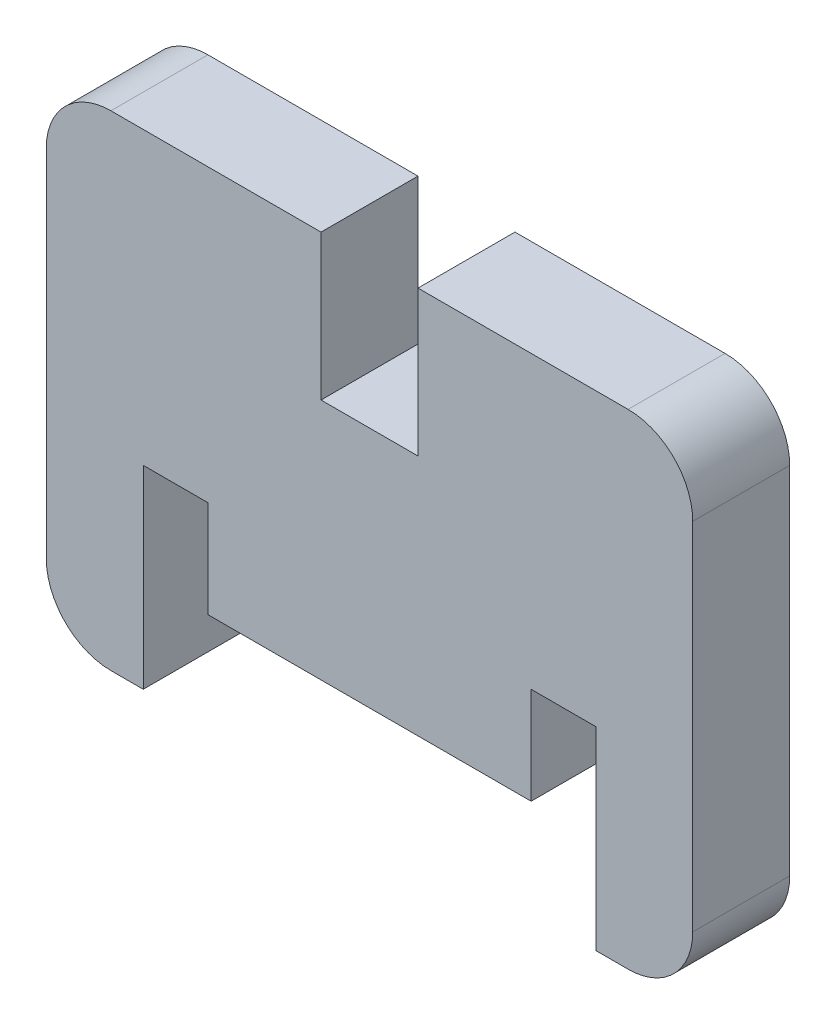
from build123d import *

# Parameters (mm, degrees)
BOSS_EXTRU_1_DEPTH = 15


with BuildPart() as part:
    # Esquisse1 → Boss.-Extru.1 (new body)
    with BuildSketch(Plane.XY):
        with BuildLine():
            ThreePointArc((-50, -27.5), (-47.071067812, -34.571067812), (-40, -37.5))
            Line((-40, -37.5), (-35, -37.5))
            Line((-35, -37.5), (-35, -22.5))
            Line((-35, -22.5), (-35, -7.5))
            Line((-35, -7.5), (-25, -7.5))
            Line((-25, -7.5), (-25, -22.5))
            Line((-25, -22.5), (25, -22.5))
            Line((25, -22.5), (25, -7.5))
            Line((25, -7.5), (35, -7.5))
            Line((35, -7.5), (35, -22.5))
            Line((35, -22.5), (35, -37.5))
            Line((35, -37.5), (40, -37.5))
            ThreePointArc((40, -37.5), (47.071067812, -34.571067812), (50, -27.5))
            Line((50, -27.5), (50, 27.5))
            ThreePointArc((50, 27.5), (47.071067812, 34.571067812), (40, 37.5))
            Line((40, 37.5), (7.5, 37.5))
            Line((7.5, 37.5), (7.5, 15))
            Line((7.5, 15), (-7.5, 15))
            Line((-7.5, 15), (-7.5, 37.5))
            Line((-7.5, 37.5), (-40, 37.5))
            ThreePointArc((-40, 37.5), (-47.071067812, 34.571067812), (-50, 27.5))
            Line((-50, 27.5), (-50, -27.5))
        make_face()
    extrude(amount=BOSS_EXTRU_1_DEPTH)


solid = part.part
